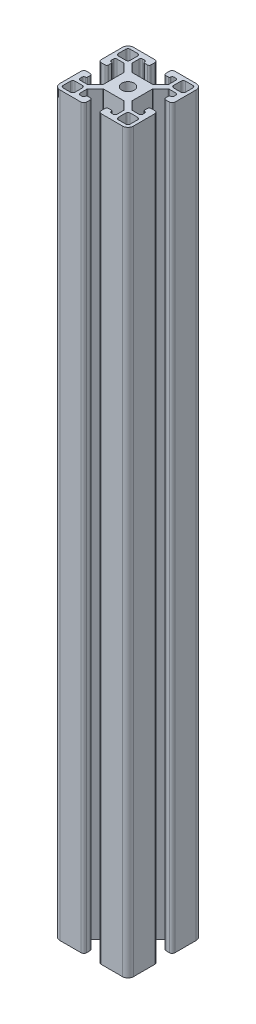
from build123d import *

# Parameters (mm, degrees)
SKETCH1_R           = 3.35
BOSS_EXTRUDE1_DEPTH = 400


with BuildPart() as part:
    # Sketch1 → Boss-Extrude1 (new body)
    with BuildSketch(Plane(origin=(0, 0, 0), x_dir=(1, 0, 0), z_dir=(0, 1, 0))):
        with BuildLine():
            Line((-9.853553391, -11.978553391), (-5.771446609, -7.896446609))
            ThreePointArc((-5.771446609, -7.896446609), (-5.609234935, -7.788060234), (-5.417893219, -7.75))
            Line((-5.417893219, -7.75), (5.417893219, -7.75))
            ThreePointArc((5.417893219, -7.75), (5.609234935, -7.788060234), (5.771446609, -7.896446609))
            Line((5.771446609, -7.896446609), (9.853553391, -11.978553391))
            ThreePointArc((9.853553391, -11.978553391), (9.961939766, -12.140765065), (10, -12.332106781))
            Line((10, -12.332106781), (10, -16))
            ThreePointArc((10, -16), (9.707106781, -16.707106781), (9, -17))
            Line((9, -17), (8, -17))
            ThreePointArc((8, -17), (7.292893219, -16.707106781), (7, -16))
            ThreePointArc((7, -16), (6.853553391, -15.646446609), (6.5, -15.5))
            Line((6.5, -15.5), (5, -15.5))
            ThreePointArc((5, -15.5), (4.292893219, -15.792893219), (4, -16.5))
            Line((4, -16.5), (4, -18.5))
            ThreePointArc((4, -18.5), (4.439339828, -19.560660172), (5.5, -20))
            Line((5.5, -20), (17, -20))
            ThreePointArc((17, -20), (19.121320344, -19.121320344), (20, -17))
            Line((20, -17), (20, -5.5))
            ThreePointArc((20, -5.5), (19.560660172, -4.439339828), (18.5, -4))
            Line((18.5, -4), (16.5, -4))
            ThreePointArc((16.5, -4), (15.792893219, -4.292893219), (15.5, -5))
            Line((15.5, -5), (15.5, -6.5))
            ThreePointArc((15.5, -6.5), (15.646446609, -6.853553391), (16, -7))
            ThreePointArc((16, -7), (16.707106781, -7.292893219), (17, -8))
            Line((17, -8), (17, -9))
            ThreePointArc((17, -9), (16.707106781, -9.707106781), (16, -10))
            Line((16, -10), (12.332106781, -10))
            ThreePointArc((12.332106781, -10), (12.140765065, -9.961939766), (11.978553391, -9.853553391))
            Line((11.978553391, -9.853553391), (7.896446609, -5.771446609))
            ThreePointArc((7.896446609, -5.771446609), (7.788060234, -5.609234935), (7.75, -5.417893219))
            Line((7.75, -5.417893219), (7.75, 5.417893219))
            ThreePointArc((7.75, 5.417893219), (7.788060234, 5.609234935), (7.896446609, 5.771446609))
            Line((7.896446609, 5.771446609), (11.978553391, 9.853553391))
            ThreePointArc((11.978553391, 9.853553391), (12.140765065, 9.961939766), (12.332106781, 10))
            Line((12.332106781, 10), (16, 10))
            ThreePointArc((16, 10), (16.707106781, 9.707106781), (17, 9))
            Line((17, 9), (17, 8))
            ThreePointArc((17, 8), (16.707106781, 7.292893219), (16, 7))
            ThreePointArc((16, 7), (15.646446609, 6.853553391), (15.5, 6.5))
            Line((15.5, 6.5), (15.5, 5))
            ThreePointArc((15.5, 5), (15.792893219, 4.292893219), (16.5, 4))
            Line((16.5, 4), (18.5, 4))
            ThreePointArc((18.5, 4), (19.560660172, 4.439339828), (20, 5.5))
            Line((20, 5.5), (20, 17))
            ThreePointArc((20, 17), (19.121320344, 19.121320344), (17, 20))
            Line((17, 20), (5.5, 20))
            ThreePointArc((5.5, 20), (4.439339828, 19.560660172), (4, 18.5))
            Line((4, 18.5), (4, 16.5))
            ThreePointArc((4, 16.5), (4.292893219, 15.792893219), (5, 15.5))
            Line((5, 15.5), (6.5, 15.5))
            ThreePointArc((6.5, 15.5), (6.853553391, 15.646446609), (7, 16))
            ThreePointArc((7, 16), (7.292893219, 16.707106781), (8, 17))
            Line((8, 17), (9, 17))
            ThreePointArc((9, 17), (9.707106781, 16.707106781), (10, 16))
            Line((10, 16), (10, 12.332106781))
            ThreePointArc((10, 12.332106781), (9.961939766, 12.140765065), (9.853553391, 11.978553391))
            Line((9.853553391, 11.978553391), (5.771446609, 7.896446609))
            ThreePointArc((5.771446609, 7.896446609), (5.609234935, 7.788060234), (5.417893219, 7.75))
            Line((5.417893219, 7.75), (-5.417893219, 7.75))
            ThreePointArc((-5.417893219, 7.75), (-5.609234935, 7.788060234), (-5.771446609, 7.896446609))
            Line((-5.771446609, 7.896446609), (-9.853553391, 11.978553391))
            ThreePointArc((-9.853553391, 11.978553391), (-9.961939766, 12.140765065), (-10, 12.332106781))
            Line((-10, 12.332106781), (-10, 16))
            ThreePointArc((-10, 16), (-9.707106781, 16.707106781), (-9, 17))
            Line((-9, 17), (-8, 17))
            ThreePointArc((-8, 17), (-7.292893219, 16.707106781), (-7, 16))
            ThreePointArc((-7, 16), (-6.853553391, 15.646446609), (-6.5, 15.5))
            Line((-6.5, 15.5), (-5, 15.5))
            ThreePointArc((-5, 15.5), (-4.292893219, 15.792893219), (-4, 16.5))
            Line((-4, 16.5), (-4, 18.5))
            ThreePointArc((-4, 18.5), (-4.439339828, 19.560660172), (-5.5, 20))
            Line((-5.5, 20), (-17, 20))
            ThreePointArc((-17, 20), (-19.121320344, 19.121320344), (-20, 17))
            Line((-20, 17), (-20, 5.5))
            ThreePointArc((-20, 5.5), (-19.560660172, 4.439339828), (-18.5, 4))
            Line((-18.5, 4), (-16.5, 4))
            ThreePointArc((-16.5, 4), (-15.792893219, 4.292893219), (-15.5, 5))
            Line((-15.5, 5), (-15.5, 6.5))
            ThreePointArc((-15.5, 6.5), (-15.646446609, 6.853553391), (-16, 7))
            ThreePointArc((-16, 7), (-16.707106781, 7.292893219), (-17, 8))
            Line((-17, 8), (-17, 9))
            ThreePointArc((-17, 9), (-16.707106781, 9.707106781), (-16, 10))
            Line((-16, 10), (-12.332106781, 10))
            ThreePointArc((-12.332106781, 10), (-12.140765065, 9.961939766), (-11.978553391, 9.853553391))
            Line((-11.978553391, 9.853553391), (-7.896446609, 5.771446609))
            ThreePointArc((-7.896446609, 5.771446609), (-7.788060234, 5.609234935), (-7.75, 5.417893219))
            Line((-7.75, 5.417893219), (-7.75, -5.417893219))
            ThreePointArc((-7.75, -5.417893219), (-7.788060234, -5.609234935), (-7.896446609, -5.771446609))
            Line((-7.896446609, -5.771446609), (-11.978553391, -9.853553391))
            ThreePointArc((-11.978553391, -9.853553391), (-12.140765065, -9.961939766), (-12.332106781, -10))
            Line((-12.332106781, -10), (-16, -10))
            ThreePointArc((-16, -10), (-16.707106781, -9.707106781), (-17, -9))
            Line((-17, -9), (-17, -8))
            ThreePointArc((-17, -8), (-16.707106781, -7.292893219), (-16, -7))
            ThreePointArc((-16, -7), (-15.646446609, -6.853553391), (-15.5, -6.5))
            Line((-15.5, -6.5), (-15.5, -5))
            ThreePointArc((-15.5, -5), (-15.792893219, -4.292893219), (-16.5, -4))
            Line((-16.5, -4), (-18.5, -4))
            ThreePointArc((-18.5, -4), (-19.560660172, -4.439339828), (-20, -5.5))
            Line((-20, -5.5), (-20, -17))
            ThreePointArc((-20, -17), (-19.121320344, -19.121320344), (-17, -20))
            Line((-17, -20), (-5.5, -20))
            ThreePointArc((-5.5, -20), (-4.439339828, -19.560660172), (-4, -18.5))
            Line((-4, -18.5), (-4, -16.5))
            ThreePointArc((-4, -16.5), (-4.292893219, -15.792893219), (-5, -15.5))
            Line((-5, -15.5), (-6.5, -15.5))
            ThreePointArc((-6.5, -15.5), (-6.853553391, -15.646446609), (-7, -16))
            ThreePointArc((-7, -16), (-7.292893219, -16.707106781), (-8, -17))
            Line((-8, -17), (-9, -17))
            ThreePointArc((-9, -17), (-9.707106781, -16.707106781), (-10, -16))
            Line((-10, -16), (-10, -12.332106781))
            ThreePointArc((-10, -12.332106781), (-9.961939766, -12.140765065), (-9.853553391, -11.978553391))
        make_face()
        with Locations(Location((0, 0, 0), (0, 0, 270))):
            Circle(SKETCH1_R, mode=Mode.SUBTRACT)
        with BuildLine():
            Line((17, 11.78), (13, 11.78))
            ThreePointArc((13, 11.78), (12.137329727, 12.137329727), (11.78, 13))
            Line((11.78, 13), (11.78, 17))
            ThreePointArc((11.78, 17), (12.137329727, 17.862670273), (13, 18.22))
            Line((13, 18.22), (17, 18.22))
            ThreePointArc((17, 18.22), (17.862670273, 17.862670273), (18.22, 17))
            Line((18.22, 17), (18.22, 13))
            ThreePointArc((18.22, 13), (17.862670273, 12.137329727), (17, 11.78))
        make_face(mode=Mode.SUBTRACT)
        with BuildLine():
            Line((11.78, -17), (11.78, -13))
            ThreePointArc((11.78, -13), (12.137329727, -12.137329727), (13, -11.78))
            Line((13, -11.78), (17, -11.78))
            ThreePointArc((17, -11.78), (17.862670273, -12.137329727), (18.22, -13))
            Line((18.22, -13), (18.22, -17))
            ThreePointArc((18.22, -17), (17.862670273, -17.862670273), (17, -18.22))
            Line((17, -18.22), (13, -18.22))
            ThreePointArc((13, -18.22), (12.137329727, -17.862670273), (11.78, -17))
        make_face(mode=Mode.SUBTRACT)
        with BuildLine():
            Line((-17, -11.78), (-13, -11.78))
            ThreePointArc((-13, -11.78), (-12.137329727, -12.137329727), (-11.78, -13))
            Line((-11.78, -13), (-11.78, -17))
            ThreePointArc((-11.78, -17), (-12.137329727, -17.862670273), (-13, -18.22))
            Line((-13, -18.22), (-17, -18.22))
            ThreePointArc((-17, -18.22), (-17.862670273, -17.862670273), (-18.22, -17))
            Line((-18.22, -17), (-18.22, -13))
            ThreePointArc((-18.22, -13), (-17.862670273, -12.137329727), (-17, -11.78))
        make_face(mode=Mode.SUBTRACT)
        with BuildLine():
            Line((-18.22, 13), (-18.22, 17))
            ThreePointArc((-18.22, 17), (-17.862670273, 17.862670273), (-17, 18.22))
            Line((-17, 18.22), (-13, 18.22))
            ThreePointArc((-13, 18.22), (-12.137329727, 17.862670273), (-11.78, 17))
            Line((-11.78, 17), (-11.78, 13))
            ThreePointArc((-11.78, 13), (-12.137329727, 12.137329727), (-13, 11.78))
            Line((-13, 11.78), (-17, 11.78))
            ThreePointArc((-17, 11.78), (-17.862670273, 12.137329727), (-18.22, 13))
        make_face(mode=Mode.SUBTRACT)
    extrude(amount=BOSS_EXTRUDE1_DEPTH)


solid = part.part
